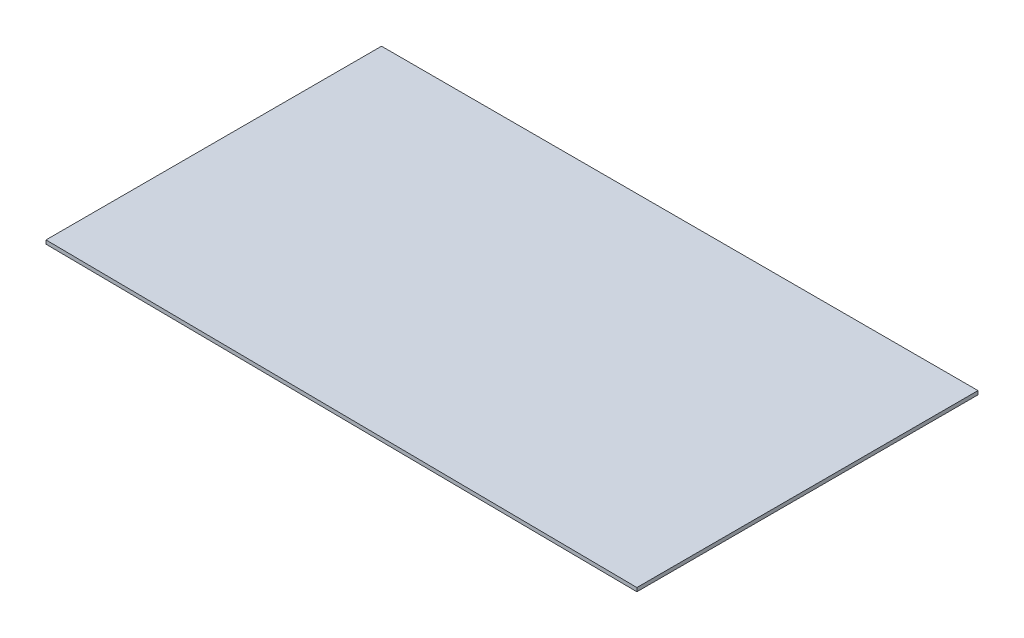
from build123d import *

# Parameters (mm, degrees)
BOSS_EXTRUDE1_DEPTH = 1
BOSS_EXTRUDE2_DEPTH = 2.7
SKETCH5_OUTSIDE_W   = 198.872
SKETCH5_OUTSIDE_H   = 130.378
SKETCH5_OUTSIDE_R   = 3
CUT_EXTRUDE1_DEPTH  = 2


with BuildPart() as part:
    # Sketch3 → Boss-Extrude1 (new body)
    with BuildSketch(Plane(origin=(0, 0, 0), x_dir=(1, 0, 0), z_dir=(0, 1, 0))):
        Polygon((-80, 45), (80, 45), (80, -46.505636843), (-80, -45), align=None)
    extrude(amount=BOSS_EXTRUDE1_DEPTH)

    # Sketch4 → Boss-Extrude2 (add)
    with BuildSketch(Plane.XZ):
        with BuildLine():
            Line((-70.35, 37.979513383), (-70.35, 32.020486617))
            add(Edge.make_bspline(
                [(-70.35, 37.979513383), (-73.35, 37.979513383), (-73.35, 35), (-73.35, 32.020486617), (-70.35, 32.020486617)],
                knots=[4.71238898, 4.71238898, 4.71238898, 6.283185307, 6.283185307, 7.853981634, 7.853981634, 7.853981634], degree=2, weights=[1, 0.707106781, 1, 0.707106781, 1]))
        make_face()
        with BuildLine():
            Line((-69.65, 37.979513383), (-69.65, 32.020486617))
            add(Edge.make_bspline(
                [(-69.65, 32.020486617), (-66.65, 32.020486617), (-66.65, 35), (-66.65, 37.979513383), (-69.65, 37.979513383)],
                knots=[4.71238898, 4.71238898, 4.71238898, 6.283185307, 6.283185307, 7.853981634, 7.853981634, 7.853981634], degree=2, weights=[1, 0.707106781, 1, 0.707106781, 1]))
        make_face()
        with BuildLine():
            Line((69.65, 37.979513383), (69.65, 32.020486617))
            add(Edge.make_bspline(
                [(69.65, 37.979513383), (66.65, 37.979513383), (66.65, 35), (66.65, 32.020486617), (69.65, 32.020486617)],
                knots=[4.71238898, 4.71238898, 4.71238898, 6.283185307, 6.283185307, 7.853981634, 7.853981634, 7.853981634], degree=2, weights=[1, 0.707106781, 1, 0.707106781, 1]))
        make_face()
        with BuildLine():
            Line((70.35, 37.979513383), (70.35, 32.020486617))
            add(Edge.make_bspline(
                [(70.35, 32.020486617), (73.35, 32.020486617), (73.35, 35), (73.35, 37.979513383), (70.35, 37.979513383)],
                knots=[4.71238898, 4.71238898, 4.71238898, 6.283185307, 6.283185307, 7.853981634, 7.853981634, 7.853981634], degree=2, weights=[1, 0.707106781, 1, 0.707106781, 1]))
        make_face()
        with BuildLine():
            Line((69.65, -32.020486617), (69.65, -37.979513383))
            add(Edge.make_bspline(
                [(69.65, -32.020486617), (66.65, -32.020486617), (66.65, -35), (66.65, -37.979513383), (69.65, -37.979513383)],
                knots=[4.71238898, 4.71238898, 4.71238898, 6.283185307, 6.283185307, 7.853981634, 7.853981634, 7.853981634], degree=2, weights=[1, 0.707106781, 1, 0.707106781, 1]))
        make_face()
        with BuildLine():
            Line((70.35, -32.020486617), (70.35, -37.979513383))
            add(Edge.make_bspline(
                [(70.35, -37.979513383), (73.35, -37.979513383), (73.35, -35), (73.35, -32.020486617), (70.35, -32.020486617)],
                knots=[4.71238898, 4.71238898, 4.71238898, 6.283185307, 6.283185307, 7.853981634, 7.853981634, 7.853981634], degree=2, weights=[1, 0.707106781, 1, 0.707106781, 1]))
        make_face()
        with BuildLine():
            Line((-70.35, -32.020486617), (-70.35, -37.979513383))
            add(Edge.make_bspline(
                [(-70.35, -32.020486617), (-73.35, -32.020486617), (-73.35, -35), (-73.35, -37.979513383), (-70.35, -37.979513383)],
                knots=[4.71238898, 4.71238898, 4.71238898, 6.283185307, 6.283185307, 7.853981634, 7.853981634, 7.853981634], degree=2, weights=[1, 0.707106781, 1, 0.707106781, 1]))
        make_face()
        with BuildLine():
            Line((-69.65, -32.020486617), (-69.65, -37.979513383))
            add(Edge.make_bspline(
                [(-69.65, -37.979513383), (-66.65, -37.979513383), (-66.65, -35), (-66.65, -32.020486617), (-69.65, -32.020486617)],
                knots=[4.71238898, 4.71238898, 4.71238898, 6.283185307, 6.283185307, 7.853981634, 7.853981634, 7.853981634], degree=2, weights=[1, 0.707106781, 1, 0.707106781, 1]))
        make_face()
    extrude(amount=BOSS_EXTRUDE2_DEPTH)

    # Sketch5 outside → Cut-Extrude1 (cut)
    with BuildSketch(Plane.XZ):
        with Locations((0, 0.753)):
            Rectangle(SKETCH5_OUTSIDE_W, SKETCH5_OUTSIDE_H)
        with Locations((-70, 35)):
            Circle(SKETCH5_OUTSIDE_R, mode=Mode.SUBTRACT)
        with Locations((70, 35)):
            Circle(SKETCH5_OUTSIDE_R, mode=Mode.SUBTRACT)
        with Locations((70, -35)):
            Circle(SKETCH5_OUTSIDE_R, mode=Mode.SUBTRACT)
        with Locations((-70, -35)):
            Circle(SKETCH5_OUTSIDE_R, mode=Mode.SUBTRACT)
    extrude(amount=CUT_EXTRUDE1_DEPTH, mode=Mode.SUBTRACT)


solid = part.part
